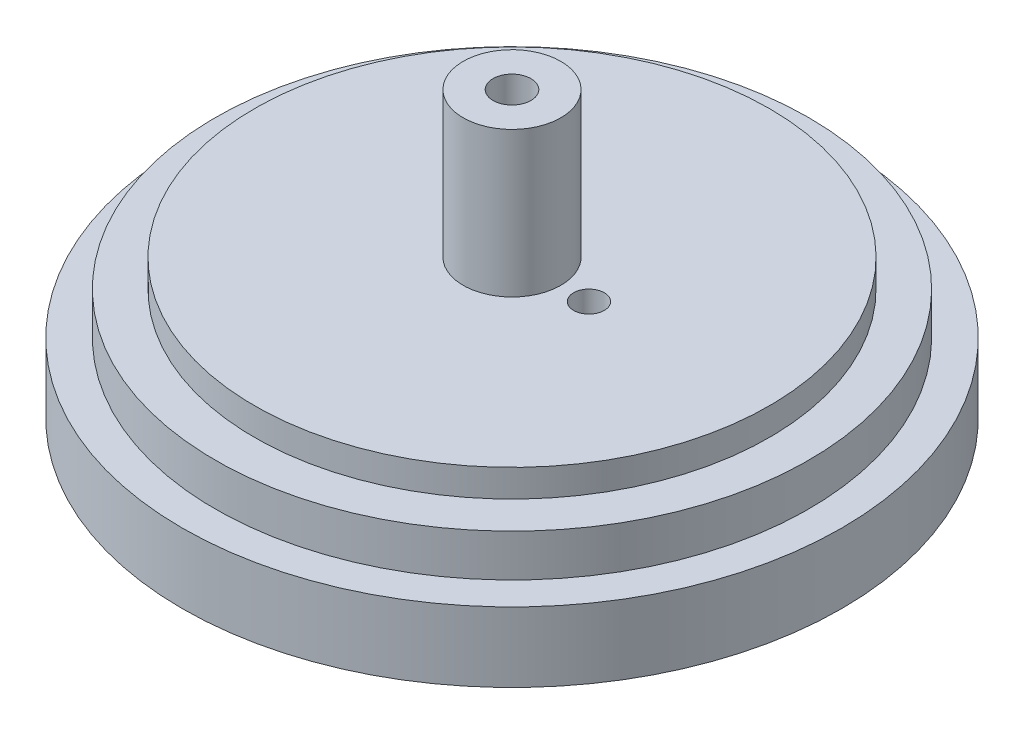
from build123d import *

# Parameters (mm, degrees)
CUT_EXTRUDE2_REACH    = 46.286
SKETCH3_R             = 1.397
SKETCH12_R            = 4.445
BOSS_EXTRUDE1_DEPTH   = 13.208
F_4_CLEARANCE_HOLE1_D = 3.4544
CUT_EXTRUDE3_DEPTH    = 8.5


with BuildPart() as part:
    # Sketch1 → Revolve1 (revolve)
    with BuildSketch(Plane.XY, mode=Mode.PRIVATE) as revolve1_sk:
        Polygon((0, 0), (-23.425, 0), (-23.425, -2.5), (-27, -2.5), (-27, -6.35), (-30, -6.35), (-30, -12.7), (0, -12.7), align=None)
    revolve(revolve1_sk.sketch.rotate(Axis((0, -12.7, 0), (0, 1, 0)), 270), axis=Axis((0, -12.7, 0), (0, 1, 0)))

    # Sketch3 → Cut-Extrude2 (cut, up to next)
    with BuildSketch(Plane.XZ, mode=Mode.PRIVATE) as cut_extrude2_sk1:
        with Locations(Location((7, 0, 0), (0, 0, 90))):
            Circle(SKETCH3_R)
    cut_extrude2_tool1 = extrude(cut_extrude2_sk1.sketch, amount=CUT_EXTRUDE2_REACH, mode=Mode.PRIVATE) & part.part
    add(cut_extrude2_tool1.solids().sort_by_distance((7, 0, 0))[0], mode=Mode.SUBTRACT)

    # Sketch12 → Boss-Extrude1 (add)
    with BuildSketch(Plane(origin=(0, 0, 0), x_dir=(1, 0, 0), z_dir=(0, 1, 0))):
        with Locations(Location((0, 0, 0), (0, 0, 90))):
            Circle(SKETCH12_R)
    extrude(amount=BOSS_EXTRUDE1_DEPTH)

    # #4 Clearance Hole1 (through all)
    with Locations(Plane(origin=(0, 13.208, 0), x_dir=(1, 0, 0), z_dir=(0, 1, 0))):
        with Locations((0, 0)):
            Hole(F_4_CLEARANCE_HOLE1_D / 2)

    # Sketch15 → Cut-Extrude3 (cut)
    with BuildSketch(Plane(origin=(0, -12.7, 0), x_dir=(-1, 0, 0), z_dir=(0, -1, 0))):
        Polygon((0, -3.812821178), (3.302, -1.906410589), (3.302, 1.906410589), (0, 3.812821178), (-3.302, 1.906410589), (-3.302, -1.906410589), align=None)
    extrude(amount=-CUT_EXTRUDE3_DEPTH, mode=Mode.SUBTRACT)


solid = part.part
